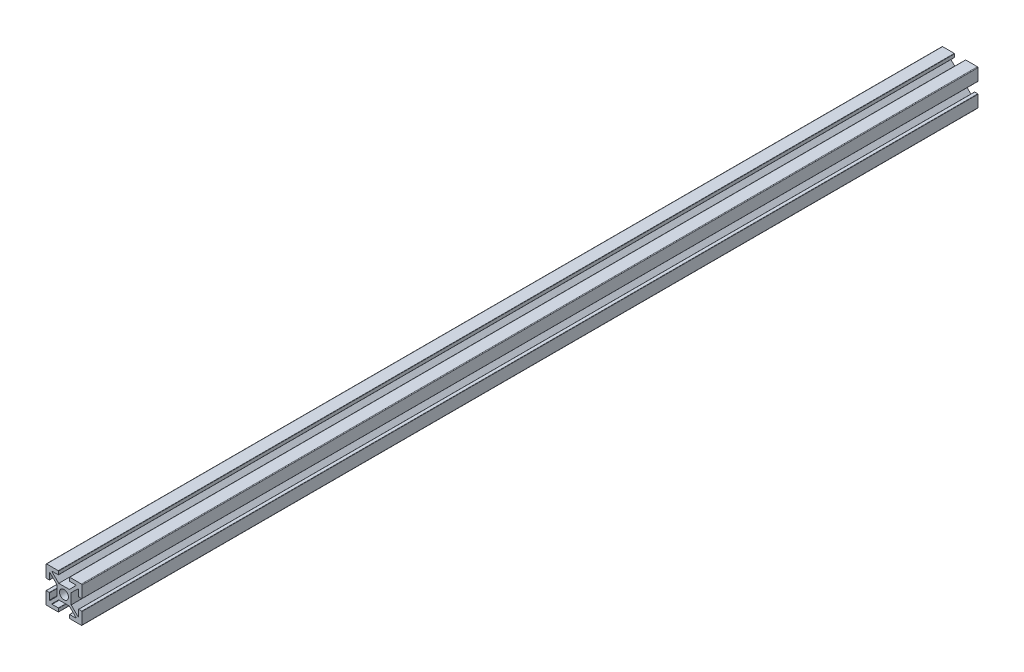
from build123d import *

# Parameters (mm, degrees)
SKETCH1_R           = 2.5
BOSS_EXTRUDE1_DEPTH = 500


with BuildPart() as part:
    # Sketch1 → Boss-Extrude1 (new body)
    with BuildSketch(Plane.XY):
        with BuildLine():
            Line((-7.427382464, 2.155691805), (-5.727382464, 2.155691805))
            ThreePointArc((-5.727382464, 2.155691805), (-5.621316447, 2.199625788), (-5.577382464, 2.305691805))
            Line((-5.577382464, 2.305691805), (-5.577382464, 5.741876319))
            ThreePointArc((-5.577382464, 5.741876319), (-5.485183419, 5.880292537), (-5.321928469, 5.848550846))
            Line((-5.321928469, 5.848550846), (-1.531086168, 2.101082027))
            Line((-1.531086168, 2.101082027), (-1.531086168, -3.789698417))
            Line((-1.531086168, -3.789698417), (-5.321928469, -7.537167236))
            ThreePointArc((-5.321928469, -7.537167236), (-5.485183419, -7.568908927), (-5.577382464, -7.430492708))
            Line((-5.577382464, -7.430492708), (-5.577382464, -3.994308195))
            ThreePointArc((-5.577382464, -3.994308195), (-5.621316447, -3.888242178), (-5.727382464, -3.844308195))
            Line((-5.727382464, -3.844308195), (-7.427382464, -3.844308195))
            ThreePointArc((-7.427382464, -3.844308195), (-7.533448481, -3.888242178), (-7.577382464, -3.994308195))
            Line((-7.577382464, -3.994308195), (-7.577382464, -10.494308195))
            ThreePointArc((-7.577382464, -10.494308195), (-7.474869837, -10.741795568), (-7.227382464, -10.844308195))
            Line((-7.227382464, -10.844308195), (-0.727382464, -10.844308195))
            ThreePointArc((-0.727382464, -10.844308195), (-0.621316447, -10.800374212), (-0.577382464, -10.694308195))
            Line((-0.577382464, -10.694308195), (-0.577382464, -8.994308195))
            ThreePointArc((-0.577382464, -8.994308195), (-0.621316447, -8.888242178), (-0.727382464, -8.844308195))
            Line((-0.727382464, -8.844308195), (-4.145467261, -8.844308195))
            ThreePointArc((-4.145467261, -8.844308195), (-4.284213755, -8.751311795), (-4.250921257, -8.587633667))
            Line((-4.250921257, -8.587633667), (-0.464270258, -4.844308195))
            Line((-0.464270258, -4.844308195), (5.402097922, -4.844308195))
            Line((5.402097922, -4.844308195), (9.188748921, -8.587633667))
            ThreePointArc((9.188748921, -8.587633667), (9.22204142, -8.751311795), (9.083294926, -8.844308195))
            Line((9.083294926, -8.844308195), (5.665210129, -8.844308195))
            ThreePointArc((5.665210129, -8.844308195), (5.559144111, -8.888242178), (5.515210129, -8.994308195))
            Line((5.515210129, -8.994308195), (5.515210129, -10.694308195))
            ThreePointArc((5.515210129, -10.694308195), (5.559144111, -10.800374212), (5.665210129, -10.844308195))
            Line((5.665210129, -10.844308195), (12.165210129, -10.844308195))
            ThreePointArc((12.165210129, -10.844308195), (12.412697502, -10.741795568), (12.515210129, -10.494308195))
            Line((12.515210129, -10.494308195), (12.515210129, -3.994308195))
            ThreePointArc((12.515210129, -3.994308195), (12.471276146, -3.888242178), (12.365210129, -3.844308195))
            Line((12.365210129, -3.844308195), (10.665210129, -3.844308195))
            ThreePointArc((10.665210129, -3.844308195), (10.559144111, -3.888242178), (10.515210129, -3.994308195))
            Line((10.515210129, -3.994308195), (10.515210129, -7.430492708))
            ThreePointArc((10.515210129, -7.430492708), (10.423011083, -7.568908927), (10.259756133, -7.537167236))
            Line((10.259756133, -7.537167236), (6.468913832, -3.789698417))
            Line((6.468913832, -3.789698417), (6.468913832, 2.101082027))
            Line((6.468913832, 2.101082027), (10.259756133, 5.848550846))
            ThreePointArc((10.259756133, 5.848550846), (10.423011083, 5.880292537), (10.515210129, 5.741876319))
            Line((10.515210129, 5.741876319), (10.515210129, 2.305691805))
            ThreePointArc((10.515210129, 2.305691805), (10.559144111, 2.199625788), (10.665210129, 2.155691805))
            Line((10.665210129, 2.155691805), (12.365210129, 2.155691805))
            ThreePointArc((12.365210129, 2.155691805), (12.471276146, 2.199625788), (12.515210129, 2.305691805))
            Line((12.515210129, 2.305691805), (12.515210129, 8.805691805))
            ThreePointArc((12.515210129, 8.805691805), (12.412697502, 9.053179179), (12.165210129, 9.155691805))
            Line((12.165210129, 9.155691805), (5.665210129, 9.155691805))
            ThreePointArc((5.665210129, 9.155691805), (5.559144111, 9.111757822), (5.515210129, 9.005691805))
            Line((5.515210129, 9.005691805), (5.515210129, 7.305691805))
            ThreePointArc((5.515210129, 7.305691805), (5.559144111, 7.199625788), (5.665210129, 7.155691805))
            Line((5.665210129, 7.155691805), (9.083294926, 7.155691805))
            ThreePointArc((9.083294926, 7.155691805), (9.22204142, 7.062695405), (9.188748921, 6.899017277))
            Line((9.188748921, 6.899017277), (5.402097922, 3.155691805))
            Line((5.402097922, 3.155691805), (-0.464270258, 3.155691805))
            Line((-0.464270258, 3.155691805), (-4.250921257, 6.899017277))
            ThreePointArc((-4.250921257, 6.899017277), (-4.284213755, 7.062695405), (-4.145467261, 7.155691805))
            Line((-4.145467261, 7.155691805), (-0.727382464, 7.155691805))
            ThreePointArc((-0.727382464, 7.155691805), (-0.621316447, 7.199625788), (-0.577382464, 7.305691805))
            Line((-0.577382464, 7.305691805), (-0.577382464, 9.005691805))
            ThreePointArc((-0.577382464, 9.005691805), (-0.621316447, 9.111757822), (-0.727382464, 9.155691805))
            Line((-0.727382464, 9.155691805), (-7.227382464, 9.155691805))
            ThreePointArc((-7.227382464, 9.155691805), (-7.474869837, 9.053179179), (-7.577382464, 8.805691805))
            Line((-7.577382464, 8.805691805), (-7.577382464, 2.305691805))
            ThreePointArc((-7.577382464, 2.305691805), (-7.533448481, 2.199625788), (-7.427382464, 2.155691805))
        make_face()
        with Locations((2.468913832, -0.844308195)):
            Circle(SKETCH1_R, mode=Mode.SUBTRACT)
    extrude(amount=BOSS_EXTRUDE1_DEPTH)


solid = part.part
